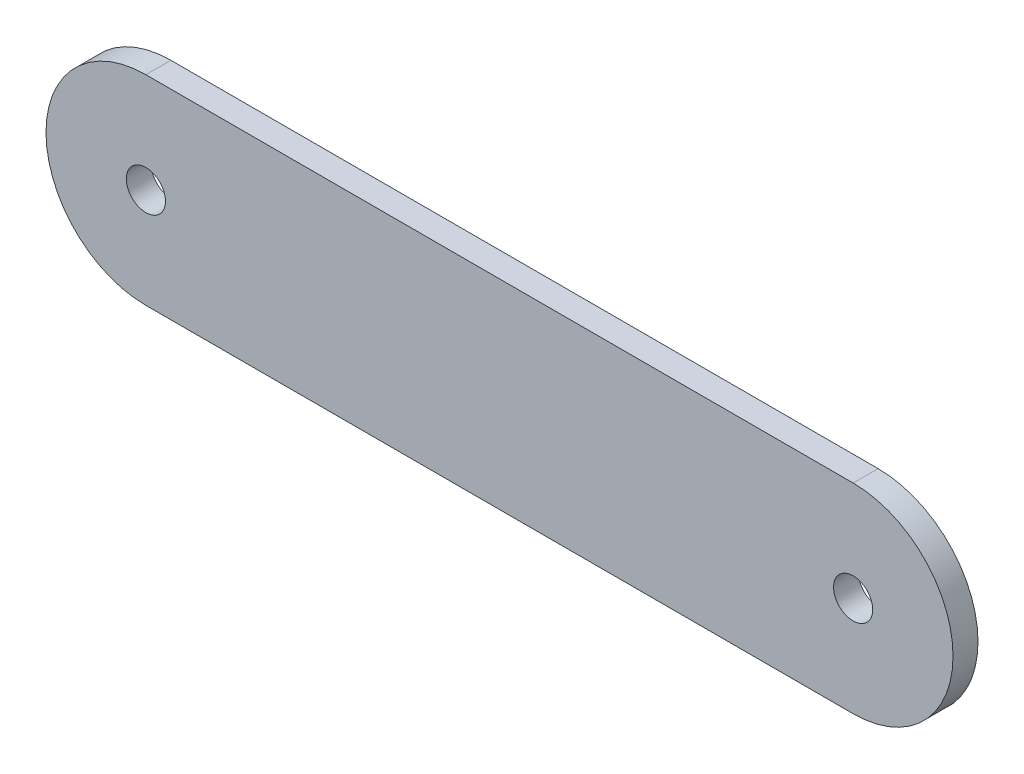
from build123d import *

# Parameters (mm, degrees)
BOSS_EXTRUDE1_DEPTH        = 3.175
F_9_0_196_DIAMETER_HOLE1_D = 4.9784


with BuildPart() as part:
    # Sketch1 → Boss-Extrude1 (new body)
    with BuildSketch(Plane(origin=(0, 0, 0), x_dir=(0, 1, 0), z_dir=(0, 0, 1))):
        with BuildLine():
            Line((-12.7, -49.151299627), (-12.7, 40.764697174))
            ThreePointArc((-12.7, 40.764697174), (0, 53.464697174), (12.7, 40.764697174))
            Line((12.7, 40.764697174), (12.7, -49.151302826))
            ThreePointArc((12.7, -49.151302826), (-1.599e-06, -61.851302826), (-12.7, -49.151299627))
        make_face()
    extrude(amount=BOSS_EXTRUDE1_DEPTH)

    # #9 (0.196) Diameter Hole1 (through all)
    with Locations(Plane.XY.offset(3.175)):
        with Locations((-40.764697174, 0), (49.151302826, 0)):
            Hole(F_9_0_196_DIAMETER_HOLE1_D / 2)


solid = part.part
